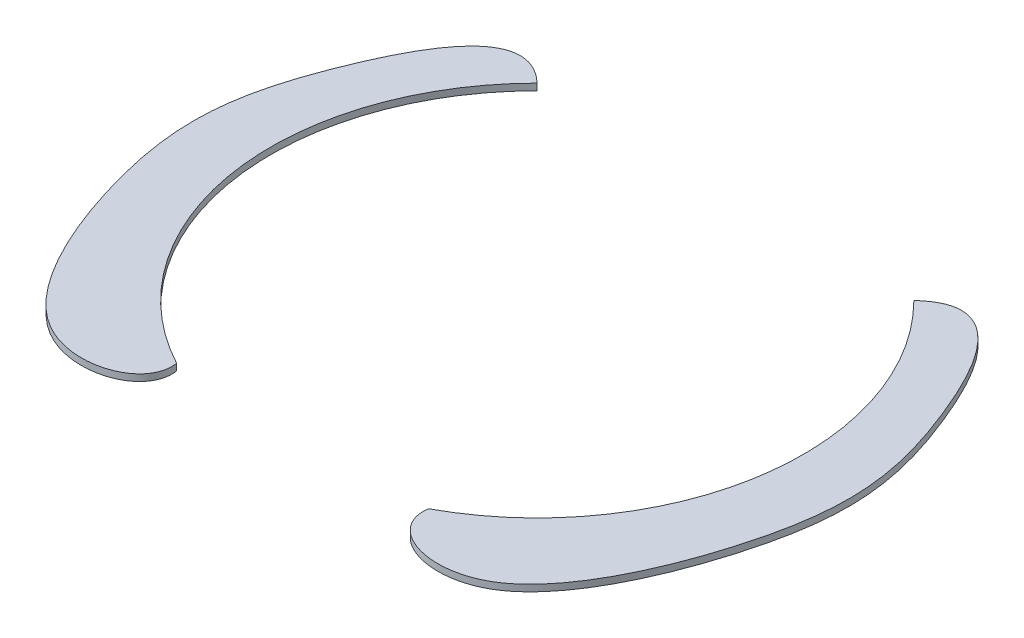
from build123d import *

# Parameters (mm, degrees)
BOSS_EXTRUDE1_DEPTH   = 6.35
BOSS_EXTRUDE1_2_DEPTH = 6.35


with BuildPart() as part:
    # Sketch1 → Boss-Extrude1 (new body)
    with BuildSketch(Plane(origin=(0, 0, 0), x_dir=(1, 0, 0), z_dir=(0, 1, 0))):
        with BuildLine():
            ThreePointArc((-179.605122421, 179.605122421), (-251.286873815, -37.025761955), (-120.169206136, -223.775248624))
            add(Edge.make_bspline(
                [(-179.605122421, 179.605122421), (-227.185128051, 224.453544186), (-311.192726479, 68.250260732), (-324.660877097, -60.538165424), (-224.970761471, -297.63369959), (-114.802406282, -259.422683492), (-120.169206136, -223.775248624)],
                knots=[0, 0, 0, 0, 0.234475694, 0.54261701, 0.775501398, 1, 1, 1, 1], degree=3))
        make_face()
    extrude(amount=BOSS_EXTRUDE1_DEPTH)


with BuildPart() as body_2:
    # Sketch1 → Boss-Extrude1 2 (new body)
    with BuildSketch(Plane(origin=(0, 0, 0), x_dir=(1, 0, 0), z_dir=(0, 1, 0))):
        with BuildLine():
            ThreePointArc((120.169206136, -223.775248624), (251.286873815, -37.025761955), (179.605122421, 179.605122421))
            add(Edge.make_bspline(
                [(179.605122421, 179.605122421), (227.185128051, 224.453544186), (311.192726479, 68.250260732), (324.660877097, -60.538165424), (224.970761471, -297.63369959), (114.802406282, -259.422683492), (120.169206136, -223.775248624)],
                knots=[0, 0, 0, 0, 0.234475694, 0.54261701, 0.775501398, 1, 1, 1, 1], degree=3))
        make_face()
    extrude(amount=BOSS_EXTRUDE1_2_DEPTH)


solid = Compound([part.part, body_2.part])
